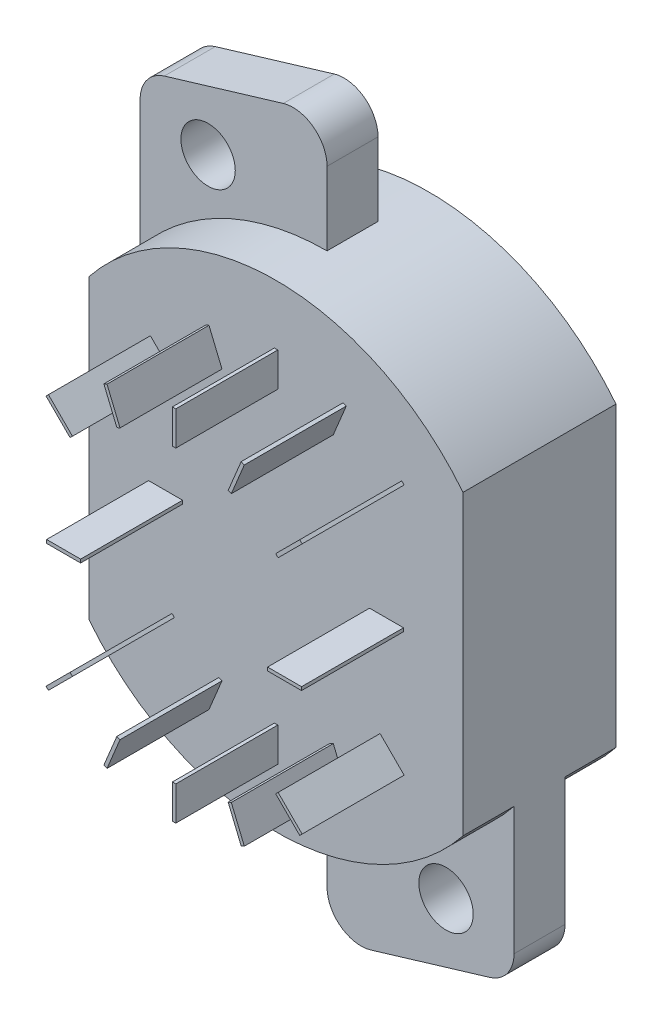
from build123d import *

# Parameters (mm, degrees)
EXTRUDE_1_DEPTH     = 3
EXTRUDE_2_DEPTH     = 3
EXTRUDE_3_DEPTH     = 3
SKETCH_4_R          = 1.6
CUT_EXTRUDE_1_DEPTH = 25.501881543
FILLET_1_R          = 2
SKETCH_5_W          = 0.2
SKETCH_5_H          = 2
SKETCH_5_W_2        = 2
SKETCH_5_H_2        = 0.2
EXTRUDE_4_DEPTH     = 6


with BuildPart() as part:
    # ｽｹｯﾁ1 → ﾎﾞｽ - 押し出し1 (new body)
    with BuildSketch(Plane.XY):
        with BuildLine():
            Line((-11, 8.75), (-11, -8.75))
            ThreePointArc((-11, -8.75), (0, -14.055692797), (11, -8.75))
            Line((11, -8.75), (11, 8.75))
            ThreePointArc((11, 8.75), (0, 14.055692797), (-11, 8.75))
        make_face()
    extrude(amount=EXTRUDE_1_DEPTH)

    # ｽｹｯﾁ2 → ﾎﾞｽ - 押し出し2 (add)
    with BuildSketch(Plane.XY.offset(3)):
        with BuildLine():
            Line((-11, 8.75), (-11, 17.75))
            Line((-11, 17.75), (0, 21.055692797))
            Line((0, 21.055692797), (0, 14.055692797))
            ThreePointArc((0, 14.055692797), (6.106356853, 12.65997259), (11, 8.75))
            Line((11, 8.75), (11, -8.75))
            Line((11, -8.75), (11, -17.75))
            Line((11, -17.75), (0, -21.055692797))
            Line((0, -21.055692797), (0, -14.055692797))
            ThreePointArc((0, -14.055692797), (-6.106356853, -12.65997259), (-11, -8.75))
            Line((-11, -8.75), (-11, 8.75))
        make_face()
    extrude(amount=EXTRUDE_2_DEPTH)

    # ｽｹｯﾁ3 → ﾎﾞｽ - 押し出し3 (add)
    with BuildSketch(Plane.XY.offset(6)):
        with BuildLine():
            Line((-11, 8.75), (-11, -8.75))
            ThreePointArc((-11, -8.75), (0, -14.055692797), (11, -8.75))
            Line((11, -8.75), (11, 8.75))
            ThreePointArc((11, 8.75), (0, 14.055692797), (-11, 8.75))
        make_face()
    extrude(amount=EXTRUDE_3_DEPTH)

    # ｽｹｯﾁ4 → ｶｯﾄ - 押し出し1 (cut, through all)
    with BuildSketch(Plane.XY.offset(6)):
        with Locations((-7, 15.452070108)):
            Circle(SKETCH_4_R)
        with Locations((7, -15.452070108)):
            Circle(SKETCH_4_R)
    extrude(amount=-CUT_EXTRUDE_1_DEPTH, mode=Mode.SUBTRACT)

    # ﾌｨﾚｯﾄ1
    fillet_1_edges = [part.edges().sort_by_distance(p)[0] for p in [
        (0, -21.055692797, 4.5),
        (11, -17.75, 4.5),
        (0, 21.055692797, 4.5),
        (-11, 17.75, 4.5),
    ]]
    fillet(fillet_1_edges, radius=FILLET_1_R)

    # ｽｹｯﾁ5 → ﾎﾞｽ - 押し出し4 (add)
    with BuildSketch(Plane.XY.offset(9)):
        Polygon((3.947100797, 9.79045687), (3.181733933, 7.942697805), (3.366509839, 7.866161118), (4.131876704, 9.713920183), align=None)
        with Locations((0, 9.555692797)):
            Rectangle(SKETCH_5_W, SKETCH_5_H)
        Polygon((7.393291279, 7.534712635), (5.979077716, 6.120499073), (6.120499073, 5.979077716), (7.534712635, 7.393291279), align=None)
        Polygon((7.534712635, -7.393291279), (6.120499073, -5.979077716), (5.979077716, -6.120499073), (7.393291279, -7.534712635), align=None)
        Polygon((4.131876704, -9.713920183), (3.366509839, -7.866161118), (3.181733933, -7.942697805), (3.947100797, -9.79045687), align=None)
        with Locations((0, -9.555692797)):
            Rectangle(SKETCH_5_W, SKETCH_5_H)
        Polygon((-3.947100797, -9.79045687), (-3.181733933, -7.942697805), (-3.366509839, -7.866161118), (-4.131876704, -9.713920183), align=None)
        Polygon((-7.393291279, -7.534712635), (-5.979077716, -6.120499073), (-6.120499073, -5.979077716), (-7.534712635, -7.393291279), align=None)
        Polygon((-7.534712635, 7.393291279), (-6.120499073, 5.979077716), (-5.979077716, 6.120499073), (-7.393291279, 7.534712635), align=None)
        Polygon((-4.131876704, 9.713920183), (-3.366509839, 7.866161118), (-3.181733933, 7.942697805), (-3.947100797, 9.79045687), align=None)
        with Locations((-6.5, 0)):
            Rectangle(SKETCH_5_W_2, SKETCH_5_H_2)
        with Locations((6.5, 0)):
            Rectangle(SKETCH_5_W_2, SKETCH_5_H_2)
    extrude(amount=EXTRUDE_4_DEPTH)


solid = part.part
